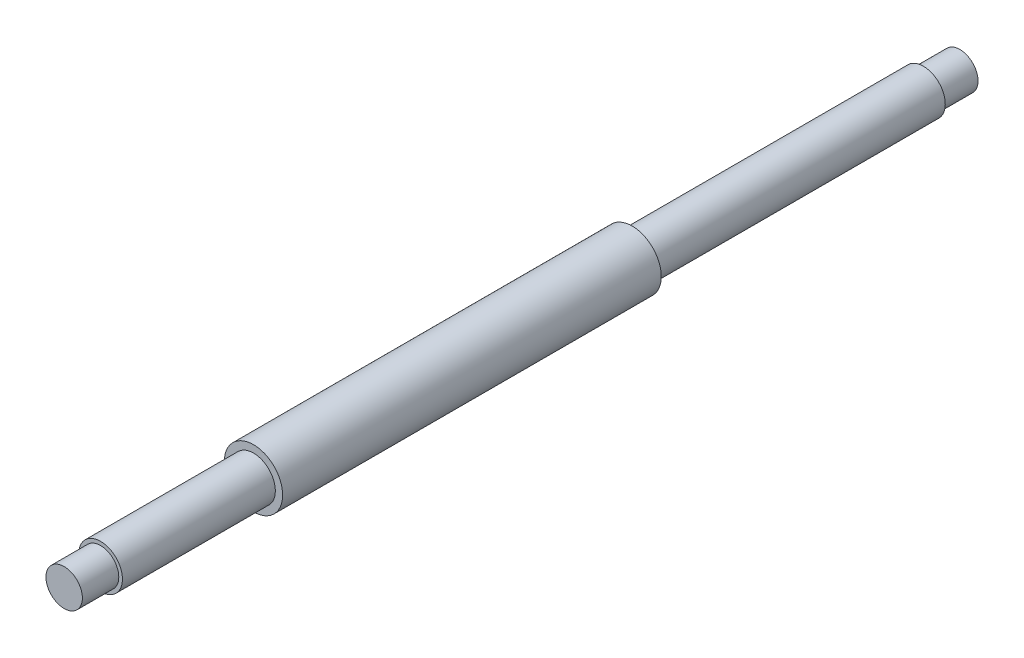
from build123d import *

# Parameters (mm, degrees)
SKETCH_1_R           = 4
EXTRUDE_1_DEPTH      = 52
EXTRUDE_2_DEPTH      = 21
EXTRUDE_2_DEPTH_BACK = 92
SKETCH_2_R           = 3
SKETCH_3_R           = 2.5
EXTRUDE_3_DEPTH      = 5
EXTRUDE_START        = 5
SKETCH_4_R           = 2.5
EXTRUDE_4_DEPTH      = 5


with BuildPart() as part:
    # 草图1 → 凸台-拉伸1 (new body)
    with BuildSketch(Plane.XY):
        with Locations(Location((0, 0, 0), (0, 0, 180))):
            Circle(SKETCH_1_R)
    extrude(amount=EXTRUDE_1_DEPTH)

    # 草图2 → 凸台-拉伸2 (add, two sides: drawn at the far end of the back side and taken through both)
    with BuildSketch(Plane.XY.offset(52).offset(-EXTRUDE_2_DEPTH_BACK)):
        Circle(SKETCH_2_R)
    extrude(amount=EXTRUDE_2_DEPTH + EXTRUDE_2_DEPTH_BACK)

    # 草图3 → 凸台-拉伸3 (add)
    with BuildSketch(Plane(origin=(0, 0, -40), x_dir=(-1, 0, 0), z_dir=(0, 0, -1))):
        Circle(SKETCH_3_R)
    extrude(amount=EXTRUDE_3_DEPTH)

    # 草图4 → 凸台-拉伸4 (add)
    with BuildSketch(Plane.XY.offset(73).offset(EXTRUDE_START)):
        with Locations(Location((0, 0, 0), (0, 0, 180))):
            Circle(SKETCH_4_R)
    extrude(amount=-EXTRUDE_4_DEPTH)


solid = part.part
